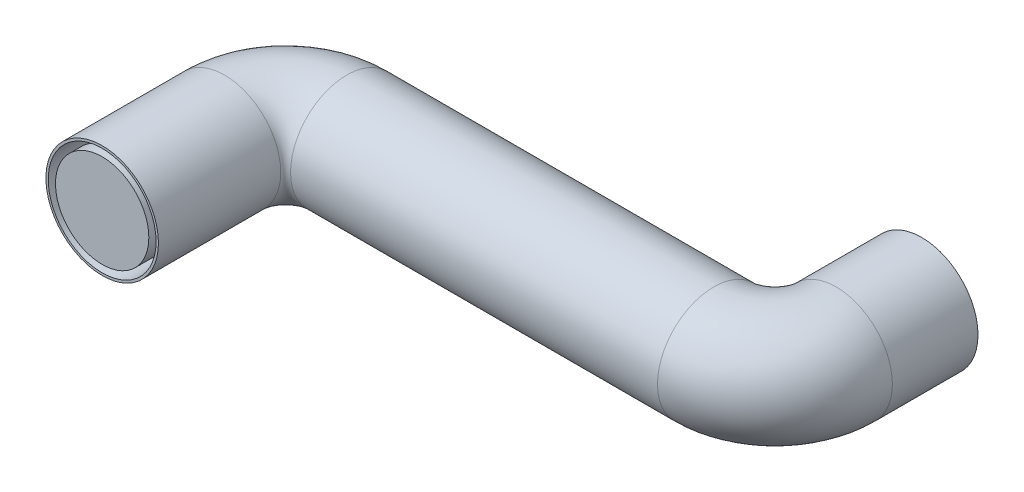
from build123d import *

# Parameters (mm, degrees)
SKETCH4_R           = 38.155726857
BOSS_EXTRUDE1_DEPTH = 150
SKETCH5_R           = 46
SKETCH5_R_2         = 44.09
CUT_EXTRUDE1_DEPTH  = 140


with BuildPart() as part:
    # Sketch4 → Boss-Extrude1 (new body)
    with BuildSketch(Plane.XY):
        with Locations((-400, 0)):
            Circle(SKETCH4_R)
    extrude(amount=BOSS_EXTRUDE1_DEPTH)

    # Sweep2: sweep along a path in Sketch2
    with BuildLine(Plane(origin=(0, 0, 0), x_dir=(1, 0, 0), z_dir=(0, 1, 0))) as sweep2_path:
        Line((0, 120), (0, 50))
        ThreePointArc((0, 50), (-14.644660941, 14.644660941), (-50, 0))
        Line((-50, 0), (-350, 0))
        ThreePointArc((-350, 0), (-385.355339059, -14.644660941), (-400, -50))
        Line((-400, -50), (-400, -150))
    # Sketch5 → Sweep2 (sweep)
    with BuildSketch(Plane.XY.offset(150)):
        with Locations((-400, 0)):
            Circle(SKETCH5_R)
        with Locations((-400, 0)):
            Circle(SKETCH5_R_2, mode=Mode.SUBTRACT)
    sweep(path=sweep2_path.line)

    # Sketch6 → Cut-Extrude1 (cut)
    with BuildSketch(Plane(origin=(0, 0, 0), x_dir=(-1, 0, 0), z_dir=(0, 0, -1))):
        with BuildLine():
            ThreePointArc((408.740673251, -37.141084033), (438.155726857, 0), (408.740673251, 37.141084033))
            ThreePointArc((408.740673251, 37.141084033), (432.21706088, 0), (408.740673251, -37.141084033))
        make_face()
    extrude(amount=-CUT_EXTRUDE1_DEPTH, mode=Mode.SUBTRACT)


solid = part.part
